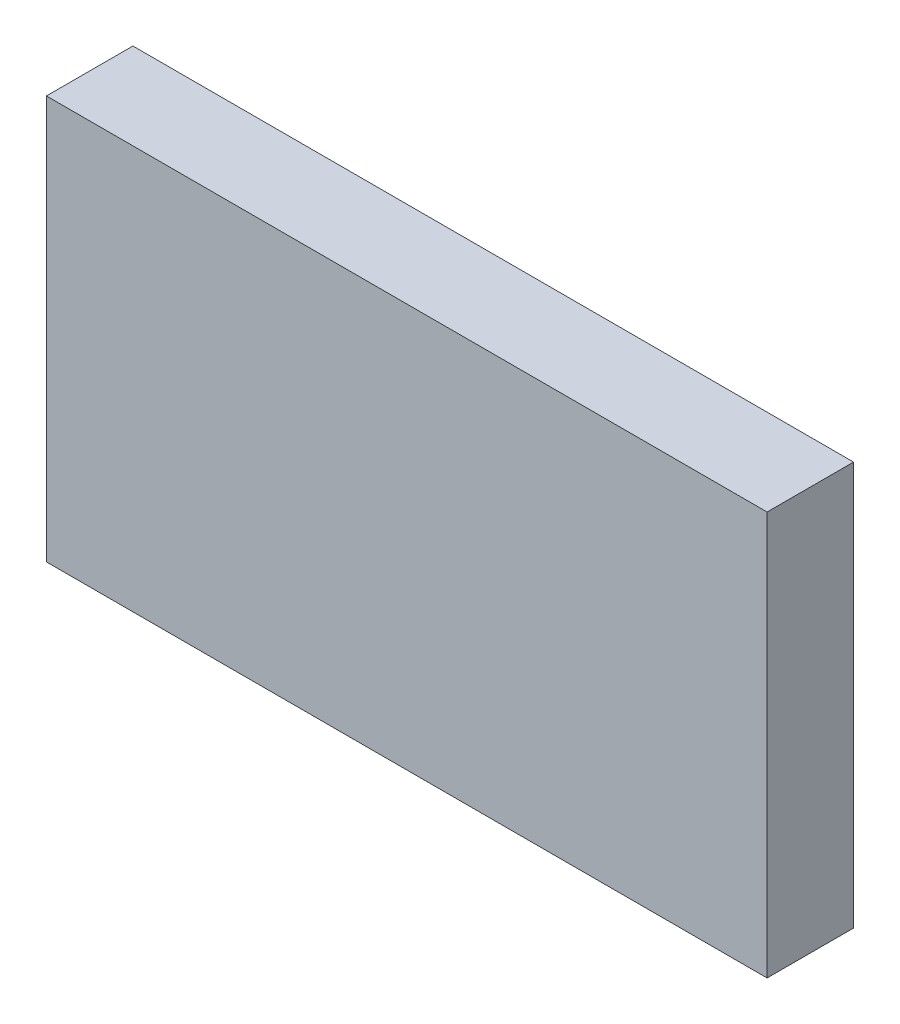
from build123d import *

# Parameters (mm, degrees)
SKETCH1_W           = 158.75
SKETCH1_H           = 88.9
BOSS_EXTRUDE1_DEPTH = 19.05


with BuildPart() as part:
    # Sketch1 → Boss-Extrude1 (new body)
    with BuildSketch(Plane.XY):
        with Locations((79.375, 44.45)):
            Rectangle(SKETCH1_W, SKETCH1_H)
    extrude(amount=BOSS_EXTRUDE1_DEPTH)


solid = part.part
